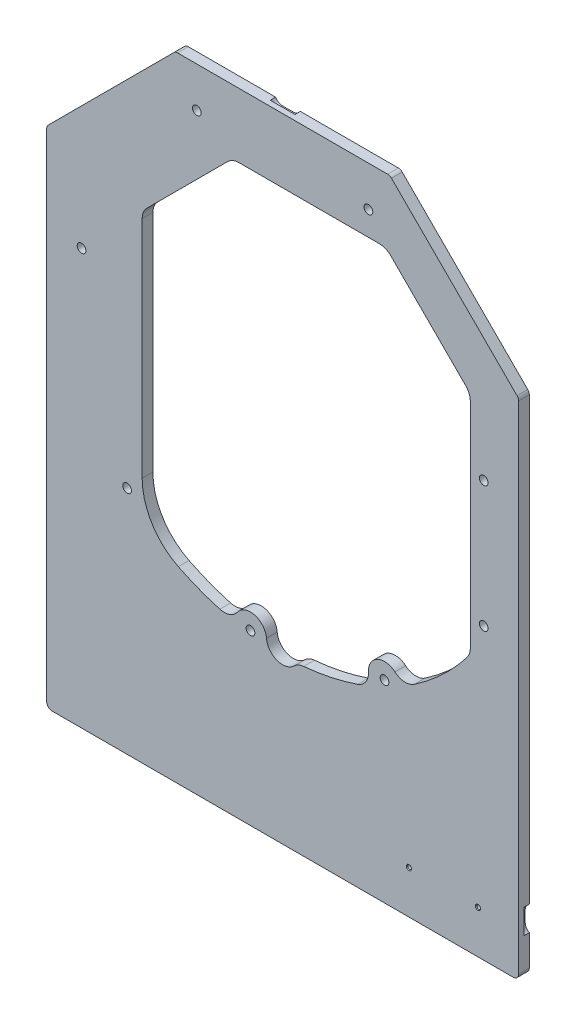
from build123d import *

# Parameters (mm, degrees)
BOSS_EXTRUDE1_DEPTH              = 6.35
F_13_64_0_20313_DIAMETER_HOLE1_D = 5.159502
FILLET1_R                        = 3.175
CUT_EXTRUDE1_DEPTH               = 3.175
F_4_40_TAPPED_HOLE1_AT_2_COUNT   = 2
F_4_40_TAPPED_HOLE1_AT_2_PITCH   = 40.8813


with BuildPart() as part:
    # Sketch1 → Boss-Extrude1 (new body)
    with BuildSketch(Plane.XY):
        Polygon((63.5, 139.7), (139.7, 63.5), (139.7, -234.95), (-139.7, -234.95), (-139.7, 63.5), (-63.5, 139.7), align=None)
        with BuildLine():
            Line((-32.547758941, 98.810192091), (-80.392170491, 50.965780541))
            ThreePointArc((-80.392170491, 50.965780541), (-82.456930947, 47.875648143), (-83.1819784, 44.23058845))
            Line((-83.1819784, 44.23058845), (-83.1819784, -88.9))
            ThreePointArc((-83.1819784, -88.9), (-77.397388735, -109.262606079), (-61.771467321, -123.542934642))
            ThreePointArc((-61.771467321, -123.542934642), (-49.690626762, -128.877509625), (-37.155545476, -133.033966773))
            ThreePointArc((-37.155545476, -133.033966773), (-31.397184902, -132.845734548), (-26.785398712, -129.39239182))
            ThreePointArc((-26.785398712, -129.39239182), (-16.51294166, -125.769298085), (-9.558427406, -134.152907902))
            ThreePointArc((-9.558427406, -134.152907902), (-3.356200416, -142.335772885), (6.691703581, -140.222357584))
            ThreePointArc((6.691703581, -140.222357584), (9.354962656, -138.393777353), (12.476251165, -137.560583133))
            ThreePointArc((12.476251165, -137.560583133), (28.622348201, -135.127095945), (44.368454999, -130.805241011))
            ThreePointArc((44.368454999, -130.805241011), (49.212504081, -127.100822664), (50.816921447, -121.217509676))
            ThreePointArc((50.816921447, -121.217509676), (56.065290503, -112.130581006), (66.483854873, -113.384042964))
            ThreePointArc((66.483854873, -113.384042964), (72.153155683, -115.630496863), (78.02311981, -113.977908606))
            ThreePointArc((78.02311981, -113.977908606), (94.714050954, -100.537651788), (109.125182698, -84.677419518))
            ThreePointArc((109.125182698, -84.677419518), (110.611187219, -81.924253334), (111.125, -78.838134428))
            Line((111.125, -78.838134428), (111.125, 47.718463274))
            ThreePointArc((111.125, 47.718463274), (110.399952547, 51.363522967), (108.335192091, 54.453655364))
            Line((108.335192091, 54.453655364), (63.978655364, 98.810192091))
            ThreePointArc((63.978655364, 98.810192091), (60.888522967, 100.874952547), (57.243463274, 101.6))
            Line((57.243463274, 101.6), (-25.81256685, 101.6))
            ThreePointArc((-25.81256685, 101.6), (-29.457626543, 100.874952547), (-32.547758941, 98.810192091))
        make_face(mode=Mode.SUBTRACT)
    extrude(amount=-BOSS_EXTRUDE1_DEPTH)

    # 13/64 (0.20313) Diameter Hole1 (through all)
    with Locations(Plane(origin=(-107.95, -107.95, 0), x_dir=(1, 0, 0), z_dir=(0, 0, 1))):
        with Locations((158.75, 223.8502), (57.15, 223.8502), (227.0252, 119.0752), (-11.1252, 119.0752), (227.0252, 44.45), (168.275, -12.7), (88.9, -27.0002), (15.875, 9.525)):
            Hole(F_13_64_0_20313_DIAMETER_HOLE1_D / 2)

    # Fillet1
    fillet1_edges = [part.edges().sort_by_distance(p)[0] for p in [
        (139.7, -234.95, -3.175),
        (-139.7, -234.95, -3.175),
        (-139.7, 63.5, -3.175),
        (-63.5, 139.7, -3.175),
        (63.5, 139.7, -3.175),
        (139.7, 63.5, -3.175),
    ]]
    fillet(fillet1_edges, radius=FILLET1_R)

    # Sketch11 → Cut-Extrude1 (cut)
    with BuildSketch(Plane(origin=(0, 0, -6.35), x_dir=(-1, 0, 0), z_dir=(0, 0, -1))):
        with BuildLine():
            Line((-177.07961661, -198.4248), (-142.0622, -198.4248))
            ThreePointArc((-142.0622, -198.4248), (-138.685623698, -199.823423698), (-137.287, -203.2))
            Line((-137.287, -203.2), (-137.287, -209.5246))
            ThreePointArc((-137.287, -209.5246), (-138.685623698, -212.901176302), (-142.0622, -214.2998))
            Line((-142.0622, -214.2998), (-177.07961661, -214.2998))
            Line((-177.07961661, -214.2998), (-177.07961661, -198.4248))
        make_face()
        with BuildLine():
            Line((-4.7498, 156.359665344), (11.1252, 156.359665344))
            Line((11.1252, 156.359665344), (11.1252, 142.0622))
            ThreePointArc((11.1252, 142.0622), (9.726576302, 138.685623698), (6.35, 137.287))
            Line((6.35, 137.287), (0.0254, 137.287))
            ThreePointArc((0.0254, 137.287), (-3.351176302, 138.685623698), (-4.7498, 142.0622))
            Line((-4.7498, 142.0622), (-4.7498, 156.359665344))
        make_face()
    extrude(amount=-CUT_EXTRUDE1_DEPTH, mode=Mode.SUBTRACT)

    # Sketch14 → #4-40 Tapped Hole1 (revolve, cut)
    with BuildSketch(Plane(origin=(115.6843, -209.55, 0), x_dir=(0, -1, 0), z_dir=(1, 0, 0))):
        Polygon((0, 0), (0, 6.35), (1.651, 6.35), (1.1303, 5.8293), (1.1303, 0.3937), (1.524, 0), align=None)
    f_4_40_tapped_hole1 = revolve(axis=Axis((115.6843, -209.55, 6.35), (0, 0, -1)), mode=Mode.SUBTRACT)

    # #4-40 Tapped Hole1 at 2: #4-40 Tapped Hole1 ×2
    with Locations(*[(-i * F_4_40_TAPPED_HOLE1_AT_2_PITCH, 0, 0) for i in range(1, F_4_40_TAPPED_HOLE1_AT_2_COUNT)]):
        add(f_4_40_tapped_hole1, mode=Mode.SUBTRACT)


solid = part.part
